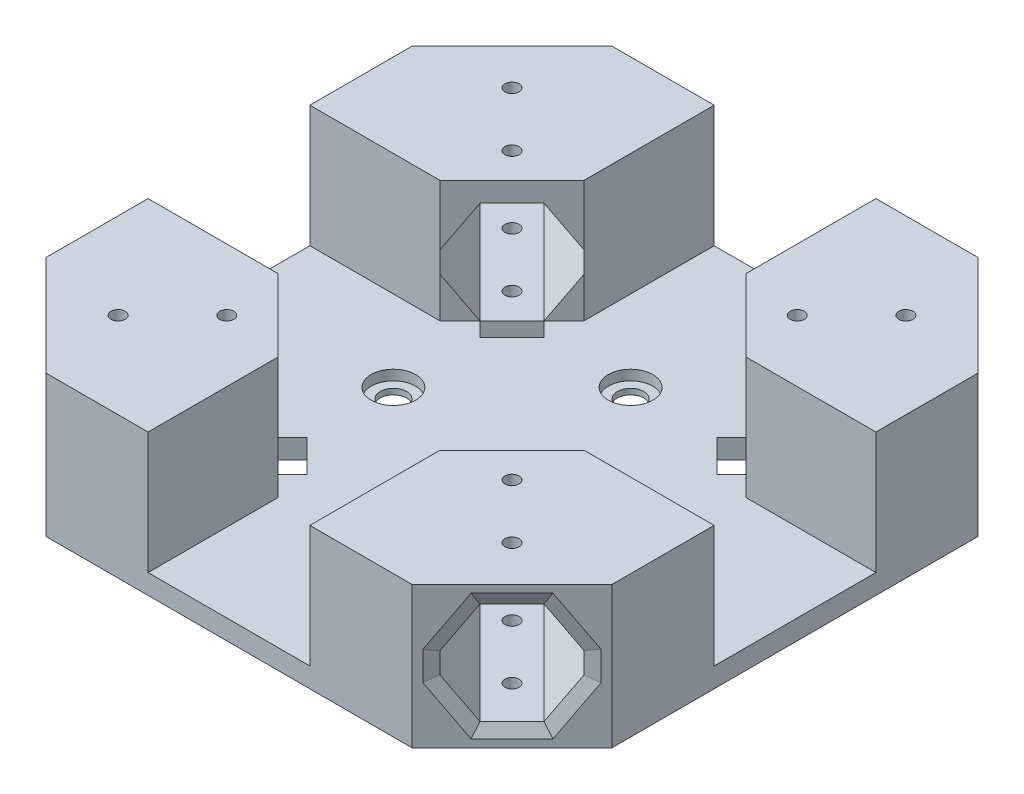
from build123d import *
from OCP.BRepFilletAPI import BRepFilletAPI_MakeChamfer

# Parameters (mm, degrees)
ESTRUSIONE_ESTRUSIONE2_DEPTH = 35
SCHIZZO2_W                   = 50
SCHIZZO2_H                   = 40
SCHIZZO2_W_2                 = 40
SCHIZZO2_H_2                 = 50
TAGLIO_ESTRUSIONE1_DEPTH     = 30.1
TAGLIO_ESTRUSIONE2_DEPTH     = 193.425993797
TAGLIO_ESTRUSIONE3_DEPTH     = 184.8698693
TAGLIO_ESTRUSIONE4_DEPTH     = 30.1
SMUSSO1_SIZE                 = 3
SMUSSO1_SIZE2                = 1
TAGLIO_ESTRUSIONE5_DEPTH     = 159.695875371
SCHIZZO9_R                   = 1.75
TAGLIO_ESTRUSIONE6_DEPTH     = 160.697748449
TAGLIO_ESTRUSIONE7_REACH     = 161.698
SCHIZZO10_R                  = 3.25
SMUSSO2_SIZE                 = 2
SMUSSO2_SIZE2                = 1
SCHIZZO11_R                  = 5.5
TAGLIO_ESTRUSIONE8_DEPTH     = 2.5


with BuildPart() as part:
    # Schizzo1 → Estrusione-Estrusione2 (new body)
    with BuildSketch(Plane(origin=(0, 0, 0), x_dir=(1, 0, 0), z_dir=(0, 1, 0))):
        Polygon((-28.030556024, -6.894377895), (-3.281818683, -31.643115237), (87.220706634, -31.643115237), (111.969443976, -6.894377895), (111.969443976, 83.608147422), (87.220706634, 108.356884763), (-3.281818683, 108.356884763), (-28.030556024, 83.608147422), align=None)
    extrude(amount=ESTRUSIONE_ESTRUSIONE2_DEPTH)

    # Schizzo2 → Taglio-Estrusione1 (cut)
    with BuildSketch(Plane(origin=(0, 35, 0), x_dir=(1, 0, 0), z_dir=(0, 1, 0))):
        with Locations((86.969443976, 38.356884763)):
            Rectangle(SCHIZZO2_W, SCHIZZO2_H)
        with Locations((41.969443976, 38.356884763)):
            Rectangle(SCHIZZO2_W_2, SCHIZZO2_H)
        with Locations((41.969443976, 83.356884763)):
            Rectangle(SCHIZZO2_W_2, SCHIZZO2_H_2)
        with Locations((-3.030556024, 38.356884763)):
            Rectangle(SCHIZZO2_W, SCHIZZO2_H)
        with Locations((41.969443976, -6.643115237)):
            Rectangle(SCHIZZO2_W_2, SCHIZZO2_H_2)
    extrude(amount=-TAGLIO_ESTRUSIONE1_DEPTH, mode=Mode.SUBTRACT)

    # Schizzo3 → Taglio-Estrusione2 (cut, through all)
    with BuildSketch(Plane(origin=(59.431910936, 0, 59.431910936), x_dir=(0.7071067811865498, 0, -0.7071067811865452), z_dir=(0.7071067811865452, 0, 0.7071067811865498))):
        Polygon((51.199291759, 30.1), (62.399291759, 30.1), (69.399291759, 20.1), (69.399291759, 14.9), (62.399291759, 4.9), (51.199291759, 4.9), (44.199291759, 14.9), (44.199291759, 20.1), align=None)
    extrude(amount=-TAGLIO_ESTRUSIONE2_DEPTH, mode=Mode.SUBTRACT)

    # Schizzo4 → Taglio-Estrusione3 (cut, through all)
    with BuildSketch(Plane(origin=(97.788795699, 0, -97.788795699), x_dir=(-0.7071067811865509, 0, -0.7071067811865441), z_dir=(0.7071067811865441, 0, -0.7071067811865509))):
        Polygon((-8.154465117, 30.1), (3.045534883, 30.1), (10.045534883, 20.1), (10.045534883, 14.9), (3.045534883, 4.9), (-8.154465117, 4.9), (-15.154465117, 14.9), (-15.154465117, 20.1), align=None)
    extrude(amount=-TAGLIO_ESTRUSIONE3_DEPTH, mode=Mode.SUBTRACT)

    # Schizzo6 → Taglio-Estrusione4 (cut)
    with BuildSketch(Plane(origin=(0, 35, 0), x_dir=(1, 0, 0), z_dir=(0, 1, 0))):
        Polygon((21.969443976, 0.537793877), (4.15035309, 18.356884763), (21.969443976, 18.356884763), align=None)
        Polygon((4.15035309, 58.356884763), (21.969443976, 76.175975649), (21.969443976, 58.356884763), align=None)
        Polygon((61.969443976, 76.175975649), (79.788534862, 58.356884763), (61.969443976, 58.356884763), align=None)
        Polygon((79.788534862, 18.356884763), (61.969443976, 0.537793877), (61.969443976, 18.356884763), align=None)
    extrude(amount=-TAGLIO_ESTRUSIONE4_DEPTH, mode=Mode.SUBTRACT)

    # Smusso1: one chamfer whose edges measure the first distance from different faces: ONE call of the kernel's chamfer builder (chamfer() names one face for all edges)
    smusso1_edges_1 = [part.edges().sort_by_distance(p)[0] for p in [
        (-9.221515645, 25.1, 25.703418275),
    ]]
    smusso1_side_1 = [part.faces().sort_by_distance(p)[0] for p in [
        (5.136527298, 25.1, 11.345375332),
    ]]
    smusso1_edges_2 = [part.edges().sort_by_distance(p)[0] for p in [
        (-6.746641911, 17.5, 28.178292009),
    ]]
    smusso1_side_2 = [part.faces().sort_by_distance(p)[0] for p in [
        (7.611401033, 17.5, 13.820249066),
    ]]
    smusso1_edges_3 = [part.edges().sort_by_distance(p)[0] for p in [
        (-15.656187354, 30.1, 19.268746566),
    ]]
    smusso1_side_3 = [part.faces().sort_by_distance(p)[0] for p in [
        (-1.29814441, 30.1, 4.910703623),
    ]]
    smusso1_edges_4 = [part.edges().sort_by_distance(p)[0] for p in [
        (-22.090859062, 25.1, 12.834074857),
    ]]
    smusso1_side_4 = [part.faces().sort_by_distance(p)[0] for p in [
        (-7.732816119, 25.1, -1.523968086),
    ]]
    smusso1_edges_5 = [part.edges().sort_by_distance(p)[0] for p in [
        (-24.565732796, 17.5, 10.359201123),
    ]]
    smusso1_side_5 = [part.faces().sort_by_distance(p)[0] for p in [
        (-10.207689853, 17.5, -3.99884182),
    ]]
    smusso1_edges_6 = [part.edges().sort_by_distance(p)[0] for p in [
        (-15.656187354, 4.9, 19.268746566),
        (-15.656187354, 4.9, -95.982516092),
    ]]
    smusso1_side_6 = [part.faces().sort_by_distance(p)[0] for p in [
        (41.969443976, 4.9, -38.356884763),
    ]]
    smusso1_edges_7 = [part.edges().sort_by_distance(p)[0] for p in [
        (-22.090859062, 9.9, 12.834074857),
    ]]
    smusso1_side_7 = [part.faces().sort_by_distance(p)[0] for p in [
        (-7.732816119, 9.9, -1.523968086),
    ]]
    smusso1_edges_8 = [part.edges().sort_by_distance(p)[0] for p in [
        (-9.221515645, 9.9, 25.703418275),
    ]]
    smusso1_side_8 = [part.faces().sort_by_distance(p)[0] for p in [
        (5.136527298, 9.9, 11.345375332),
    ]]
    smusso1_edges_9 = [part.edges().sort_by_distance(p)[0] for p in [
        (106.029747014, 25.1, -89.547844384),
        (108.504620748, 17.5, -87.072970649),
        (106.029747014, 9.9, -89.547844384),
        (99.595075305, 4.9, -95.982516092),
        (93.160403596, 9.9, -102.417187801),
        (90.685529862, 17.5, -104.892061535),
        (93.160403596, 25.1, -102.417187801),
        (99.595075305, 30.1, -95.982516092),
    ]]
    smusso1_side_9 = [part.faces().sort_by_distance(p)[0] for p in [
        (111.619443976, 17.5, -83.958147422),
    ]]
    smusso1_edges_10 = [part.edges().sort_by_distance(p)[0] for p in [
        (-22.090859062, 25.1, -89.547844384),
    ]]
    smusso1_side_10 = [part.faces().sort_by_distance(p)[0] for p in [
        (-7.732816119, 25.1, -75.18980144),
    ]]
    smusso1_edges_11 = [part.edges().sort_by_distance(p)[0] for p in [
        (-24.565732796, 17.5, -87.072970649),
    ]]
    smusso1_side_11 = [part.faces().sort_by_distance(p)[0] for p in [
        (-10.207689853, 17.5, -72.714927706),
    ]]
    smusso1_edges_12 = [part.edges().sort_by_distance(p)[0] for p in [
        (-15.656187354, 30.1, -95.982516092),
    ]]
    smusso1_side_12 = [part.faces().sort_by_distance(p)[0] for p in [
        (-1.29814441, 30.1, -81.624473149),
    ]]
    smusso1_edges_13 = [part.edges().sort_by_distance(p)[0] for p in [
        (-9.221515645, 25.1, -102.417187801),
    ]]
    smusso1_side_13 = [part.faces().sort_by_distance(p)[0] for p in [
        (5.136527298, 25.1, -88.059144858),
    ]]
    smusso1_edges_14 = [part.edges().sort_by_distance(p)[0] for p in [
        (-6.746641911, 17.5, -104.892061535),
    ]]
    smusso1_side_14 = [part.faces().sort_by_distance(p)[0] for p in [
        (7.611401033, 17.5, -90.534018592),
    ]]
    smusso1_edges_15 = [part.edges().sort_by_distance(p)[0] for p in [
        (-9.221515645, 9.9, -102.417187801),
    ]]
    smusso1_side_15 = [part.faces().sort_by_distance(p)[0] for p in [
        (5.136527298, 9.9, -88.059144858),
    ]]
    smusso1_edges_16 = [part.edges().sort_by_distance(p)[0] for p in [
        (-22.090859062, 9.9, -89.547844384),
    ]]
    smusso1_side_16 = [part.faces().sort_by_distance(p)[0] for p in [
        (-7.732816119, 9.9, -75.18980144),
    ]]
    smusso1_edges_17 = [part.edges().sort_by_distance(p)[0] for p in [
        (93.160403596, 25.1, 25.703418275),
        (90.685529862, 17.5, 28.178292009),
        (93.160403596, 9.9, 25.703418275),
        (99.595075305, 4.9, 19.268746566),
        (106.029747014, 9.9, 12.834074857),
        (108.504620748, 17.5, 10.359201123),
        (106.029747014, 25.1, 12.834074857),
        (99.595075305, 30.1, 19.268746566),
    ]]
    smusso1_side_17 = [part.faces().sort_by_distance(p)[0] for p in [
        (87.570706634, 17.5, 31.293115237),
    ]]
    smusso1 = BRepFilletAPI_MakeChamfer(part.part.solid().wrapped)
    for e in smusso1_edges_1:
        smusso1.Add(SMUSSO1_SIZE, SMUSSO1_SIZE2, e.wrapped, smusso1_side_1[0].wrapped)  # the first distance lies on this face
    for e in smusso1_edges_2:
        smusso1.Add(SMUSSO1_SIZE, SMUSSO1_SIZE2, e.wrapped, smusso1_side_2[0].wrapped)  # the first distance lies on this face
    for e in smusso1_edges_3:
        smusso1.Add(SMUSSO1_SIZE, SMUSSO1_SIZE2, e.wrapped, smusso1_side_3[0].wrapped)  # the first distance lies on this face
    for e in smusso1_edges_4:
        smusso1.Add(SMUSSO1_SIZE, SMUSSO1_SIZE2, e.wrapped, smusso1_side_4[0].wrapped)  # the first distance lies on this face
    for e in smusso1_edges_5:
        smusso1.Add(SMUSSO1_SIZE, SMUSSO1_SIZE2, e.wrapped, smusso1_side_5[0].wrapped)  # the first distance lies on this face
    for e in smusso1_edges_6:
        smusso1.Add(SMUSSO1_SIZE, SMUSSO1_SIZE2, e.wrapped, smusso1_side_6[0].wrapped)  # the first distance lies on this face
    for e in smusso1_edges_7:
        smusso1.Add(SMUSSO1_SIZE, SMUSSO1_SIZE2, e.wrapped, smusso1_side_7[0].wrapped)  # the first distance lies on this face
    for e in smusso1_edges_8:
        smusso1.Add(SMUSSO1_SIZE, SMUSSO1_SIZE2, e.wrapped, smusso1_side_8[0].wrapped)  # the first distance lies on this face
    for e in smusso1_edges_9:
        smusso1.Add(SMUSSO1_SIZE, SMUSSO1_SIZE2, e.wrapped, smusso1_side_9[0].wrapped)  # the first distance lies on this face
    for e in smusso1_edges_10:
        smusso1.Add(SMUSSO1_SIZE, SMUSSO1_SIZE2, e.wrapped, smusso1_side_10[0].wrapped)  # the first distance lies on this face
    for e in smusso1_edges_11:
        smusso1.Add(SMUSSO1_SIZE, SMUSSO1_SIZE2, e.wrapped, smusso1_side_11[0].wrapped)  # the first distance lies on this face
    for e in smusso1_edges_12:
        smusso1.Add(SMUSSO1_SIZE, SMUSSO1_SIZE2, e.wrapped, smusso1_side_12[0].wrapped)  # the first distance lies on this face
    for e in smusso1_edges_13:
        smusso1.Add(SMUSSO1_SIZE, SMUSSO1_SIZE2, e.wrapped, smusso1_side_13[0].wrapped)  # the first distance lies on this face
    for e in smusso1_edges_14:
        smusso1.Add(SMUSSO1_SIZE, SMUSSO1_SIZE2, e.wrapped, smusso1_side_14[0].wrapped)  # the first distance lies on this face
    for e in smusso1_edges_15:
        smusso1.Add(SMUSSO1_SIZE, SMUSSO1_SIZE2, e.wrapped, smusso1_side_15[0].wrapped)  # the first distance lies on this face
    for e in smusso1_edges_16:
        smusso1.Add(SMUSSO1_SIZE, SMUSSO1_SIZE2, e.wrapped, smusso1_side_16[0].wrapped)  # the first distance lies on this face
    for e in smusso1_edges_17:
        smusso1.Add(SMUSSO1_SIZE, SMUSSO1_SIZE2, e.wrapped, smusso1_side_17[0].wrapped)  # the first distance lies on this face
    add(Compound.cast(smusso1.Shape()), mode=Mode.REPLACE)

    # Schizzo7 → Taglio-Estrusione5 (cut, through all)
    with BuildSketch(Plane(origin=(0, 4.9, 0), x_dir=(1, 0, 0), z_dir=(0, 1, 0))):
        Polygon((9.100100558, 13.407137295), (17.019696507, 5.487541346), (20.555230413, 9.023075251), (12.635634464, 16.942671201), align=None)
        Polygon((17.019696507, 71.226228181), (9.100100558, 63.306632231), (12.635634464, 59.771098326), (20.555230413, 67.690694275), align=None)
        Polygon((74.838787393, 63.306632231), (66.919191444, 71.226228181), (63.383657538, 67.690694275), (71.303253487, 59.771098326), align=None)
        Polygon((66.919191444, 5.487541346), (74.838787393, 13.407137295), (71.303253487, 16.942671201), (63.383657538, 9.023075251), align=None)
    extrude(amount=-TAGLIO_ESTRUSIONE5_DEPTH, mode=Mode.SUBTRACT)

    # Schizzo9 → Taglio-Estrusione6 (cut, through all)
    with BuildSketch(Plane(origin=(0, 35, 0), x_dir=(1, 0, 0), z_dir=(0, 1, 0))):
        with Locations(Location((90.677979292, 87.065420079, 0), (0, 0, 270))):
            Circle(SCHIZZO9_R)
        with Locations(Location((77.242950449, 73.630391237, 0), (0, 0, 270))):
            Circle(SCHIZZO9_R)
        with Locations(Location((90.677979292, -10.351650553, 0), (0, 0, 270))):
            Circle(SCHIZZO9_R)
        with Locations(Location((77.242950449, 3.08337829, 0), (0, 0, 270))):
            Circle(SCHIZZO9_R)
        with Locations(Location((-6.73909134, -10.351650553, 0), (0, 0, 270))):
            Circle(SCHIZZO9_R)
        with Locations(Location((6.695937502, 3.08337829, 0), (0, 0, 270))):
            Circle(SCHIZZO9_R)
        with Locations(Location((-6.73909134, 87.065420079, 0), (0, 0, 270))):
            Circle(SCHIZZO9_R)
        with Locations(Location((6.695937502, 73.630391237, 0), (0, 0, 270))):
            Circle(SCHIZZO9_R)
    extrude(amount=-TAGLIO_ESTRUSIONE6_DEPTH, mode=Mode.SUBTRACT)

    # Schizzo10 → Taglio-Estrusione7 (cut, up to next)
    with BuildSketch(Plane.XZ, mode=Mode.PRIVATE) as taglio_estrusione7_sk1:
        with Locations(Location((71.303253487, -38.356884763, 0), (0, 0, 270))):
            Circle(SCHIZZO10_R)
    taglio_estrusione7_tool1 = extrude(taglio_estrusione7_sk1.sketch, amount=-TAGLIO_ESTRUSIONE7_REACH, mode=Mode.PRIVATE) & part.part
    # Schizzo10 → Taglio-Estrusione7 (cut, up to next)
    with BuildSketch(Plane.XZ, mode=Mode.PRIVATE) as taglio_estrusione7_sk2:
        with Locations(Location((12.635634464, -38.356884763, 0), (0, 0, 270))):
            Circle(SCHIZZO10_R)
    taglio_estrusione7_tool2 = extrude(taglio_estrusione7_sk2.sketch, amount=-TAGLIO_ESTRUSIONE7_REACH, mode=Mode.PRIVATE) & part.part
    # Schizzo10 → Taglio-Estrusione7 (cut, up to next)
    with BuildSketch(Plane.XZ, mode=Mode.PRIVATE) as taglio_estrusione7_sk3:
        with Locations(Location((41.969443976, -67.690694275, 0), (0, 0, 270))):
            Circle(SCHIZZO10_R)
    taglio_estrusione7_tool3 = extrude(taglio_estrusione7_sk3.sketch, amount=-TAGLIO_ESTRUSIONE7_REACH, mode=Mode.PRIVATE) & part.part
    # Schizzo10 → Taglio-Estrusione7 (cut, up to next)
    with BuildSketch(Plane.XZ, mode=Mode.PRIVATE) as taglio_estrusione7_sk4:
        with Locations(Location((41.969443976, -9.023075251, 0), (0, 0, 270))):
            Circle(SCHIZZO10_R)
    taglio_estrusione7_tool4 = extrude(taglio_estrusione7_sk4.sketch, amount=-TAGLIO_ESTRUSIONE7_REACH, mode=Mode.PRIVATE) & part.part
    add(taglio_estrusione7_tool1.solids().sort_by_distance((71.303253, 0, -38.356885))[0], mode=Mode.SUBTRACT)
    add(taglio_estrusione7_tool2.solids().sort_by_distance((12.635634, 0, -38.356885))[0], mode=Mode.SUBTRACT)
    add(taglio_estrusione7_tool3.solids().sort_by_distance((41.969444, 0, -67.690694))[0], mode=Mode.SUBTRACT)
    add(taglio_estrusione7_tool4.solids().sort_by_distance((41.969444, 0, -9.023075))[0], mode=Mode.SUBTRACT)

    # Smusso2
    smusso2_edges = [part.edges().sort_by_distance(p)[0] for p in [
        (71.303253487, 0, -35.106884763),
        (12.635634464, 0, -35.106884763),
        (41.969443976, 0, -64.440694275),
        (41.969443976, 0, -5.773075251),
    ]]
    smusso2_side = [part.faces().sort_by_distance(p)[0] for p in [
        (41.969443976, 0, -38.356884763),
    ]]
    chamfer(smusso2_edges, length=SMUSSO2_SIZE, length2=SMUSSO2_SIZE2, reference=smusso2_side[0])

    # Schizzo11 → Taglio-Estrusione8 (cut)
    with BuildSketch(Plane(origin=(0, 4.9, 0), x_dir=(1, 0, 0), z_dir=(0, 1, 0))):
        with Locations(Location((41.969443976, 9.023075251, 0), (0, 0, 270))):
            Circle(SCHIZZO11_R)
        with Locations(Location((71.303253487, 38.356884763, 0), (0, 0, 270))):
            Circle(SCHIZZO11_R)
        with Locations(Location((12.635634464, 38.356884763, 0), (0, 0, 270))):
            Circle(SCHIZZO11_R)
        with Locations(Location((41.969443976, 67.690694275, 0), (0, 0, 270))):
            Circle(SCHIZZO11_R)
    extrude(amount=-TAGLIO_ESTRUSIONE8_DEPTH, mode=Mode.SUBTRACT)


solid = part.part
